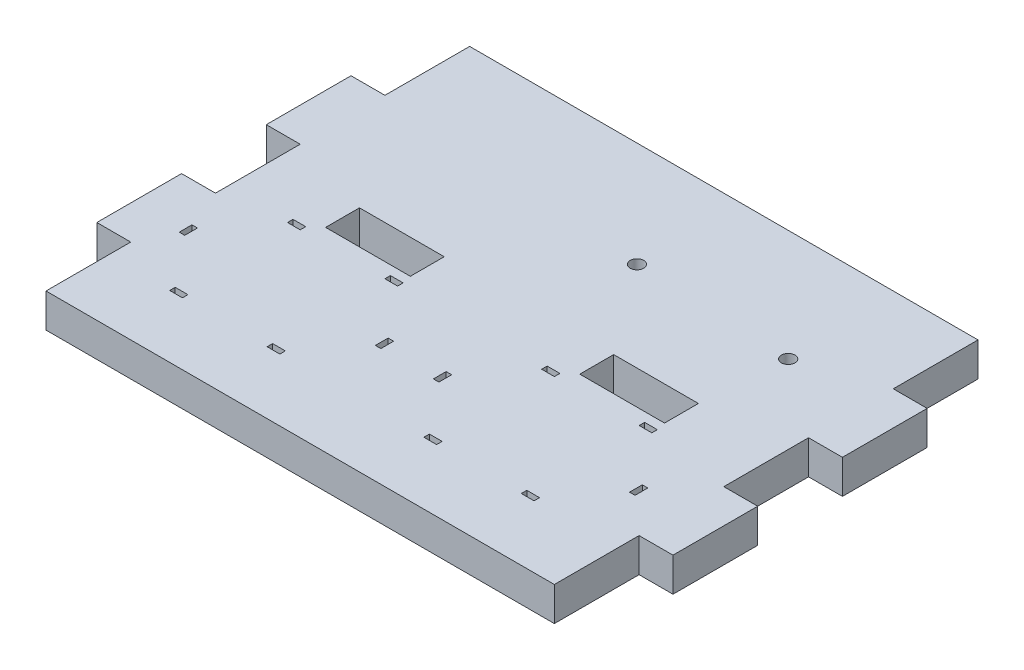
from build123d import *

# Parameters (mm, degrees)
SKETCH1_W           = 120
SKETCH1_H           = 100
SKETCH1_R           = 1.6
SKETCH1_W_2         = 3
SKETCH1_H_2         = 1.3
SKETCH1_W_3         = 1.3
SKETCH1_H_3         = 3
BOSS_EXTRUDE1_DEPTH = 8
CUT_EXTRUDE1_DEPTH  = 4
SKETCH3_W           = 20
SKETCH3_H           = 8
BOSS_EXTRUDE2_DEPTH = 8
CUT_EXTRUDE3_REACH  = 86.782
SKETCH5_W           = 20
SKETCH5_H           = 8


with BuildPart() as part:
    # Sketch1 → Boss-Extrude1 (new body)
    with BuildSketch(Plane(origin=(0, 0, 0), x_dir=(1, 0, 0), z_dir=(0, 1, 0))):
        Rectangle(SKETCH1_W, SKETCH1_H)
        with Locations(Location((41.5, 23.7, 0), (0, 0, 270))):
            Circle(SKETCH1_R, mode=Mode.SUBTRACT)
        with Locations(Location((4.3, 25.2, 0), (0, 0, 270))):
            Circle(SKETCH1_R, mode=Mode.SUBTRACT)
        with Locations((39, -6.85)):
            Rectangle(SKETCH1_W_2, SKETCH1_H_2, mode=Mode.SUBTRACT)
        with Locations((16, -6.85)):
            Rectangle(SKETCH1_W_2, SKETCH1_H_2, mode=Mode.SUBTRACT)
        with Locations((4.35, -20.75)):
            Rectangle(SKETCH1_W_3, SKETCH1_H_3, mode=Mode.SUBTRACT)
        with Locations((50.65, -20.75)):
            Rectangle(SKETCH1_W_3, SKETCH1_H_3, mode=Mode.SUBTRACT)
        with Locations((39, -34.65)):
            Rectangle(SKETCH1_W_2, SKETCH1_H_2, mode=Mode.SUBTRACT)
        with Locations((16, -34.65)):
            Rectangle(SKETCH1_W_2, SKETCH1_H_2, mode=Mode.SUBTRACT)
        with Locations((-21, -34.65)):
            Rectangle(SKETCH1_W_2, SKETCH1_H_2, mode=Mode.SUBTRACT)
        with Locations((-44, -34.65)):
            Rectangle(SKETCH1_W_2, SKETCH1_H_2, mode=Mode.SUBTRACT)
        with Locations((-55.65, -20.75)):
            Rectangle(SKETCH1_W_3, SKETCH1_H_3, mode=Mode.SUBTRACT)
        with Locations((-44, -6.85)):
            Rectangle(SKETCH1_W_2, SKETCH1_H_2, mode=Mode.SUBTRACT)
        with Locations((-9.35, -20.75)):
            Rectangle(SKETCH1_W_3, SKETCH1_H_3, mode=Mode.SUBTRACT)
        with Locations((-21, -6.85)):
            Rectangle(SKETCH1_W_2, SKETCH1_H_2, mode=Mode.SUBTRACT)
    extrude(amount=BOSS_EXTRUDE1_DEPTH)

    # Sketch2 → Cut-Extrude1 (cut)
    with BuildSketch(Plane(origin=(0, 0, 0), x_dir=(-1, 0, 0), z_dir=(0, -1, 0))):
        Polygon((-7.475426481, 25.2), (-5.88771324, 22.45), (-2.71228676, 22.45), (-1.124573519, 25.2), (-2.71228676, 27.95), (-5.88771324, 27.95), align=None)
        Polygon((-44.675426481, 23.7), (-43.08771324, 20.95), (-39.91228676, 20.95), (-38.324573519, 23.7), (-39.91228676, 26.45), (-43.08771324, 26.45), align=None)
    extrude(amount=-CUT_EXTRUDE1_DEPTH, mode=Mode.SUBTRACT)

    # Sketch3 → Boss-Extrude2 (add)
    with BuildSketch(Plane.ZY.offset(60)):
        with Locations((-20, 4)):
            Rectangle(SKETCH3_W, SKETCH3_H)
        with Locations((20, 4)):
            Rectangle(SKETCH3_W, SKETCH3_H)
    boss_extrude2 = extrude(amount=BOSS_EXTRUDE2_DEPTH)

    # Mirror1: Boss-Extrude2 across plane
    add(boss_extrude2.mirror(Plane.ZY))

    # Sketch5 → Cut-Extrude3 (cut, up to next)
    with BuildSketch(Plane(origin=(0, 0, 0), x_dir=(-1, 0, 0), z_dir=(0, -1, 0)), mode=Mode.PRIVATE) as cut_extrude3_sk1:
        with Locations((30, 0)):
            Rectangle(SKETCH5_W, SKETCH5_H)
    cut_extrude3_tool1 = extrude(cut_extrude3_sk1.sketch, amount=-CUT_EXTRUDE3_REACH, mode=Mode.PRIVATE) & part.part
    cut_extrude3 = cut_extrude3_tool1.solids().sort_by_distance((-30, 0, 0))[0]
    add(cut_extrude3, mode=Mode.SUBTRACT)

    # Mirror2: Cut-Extrude3 across plane
    add(cut_extrude3.mirror(Plane.ZY), mode=Mode.SUBTRACT)


solid = part.part
